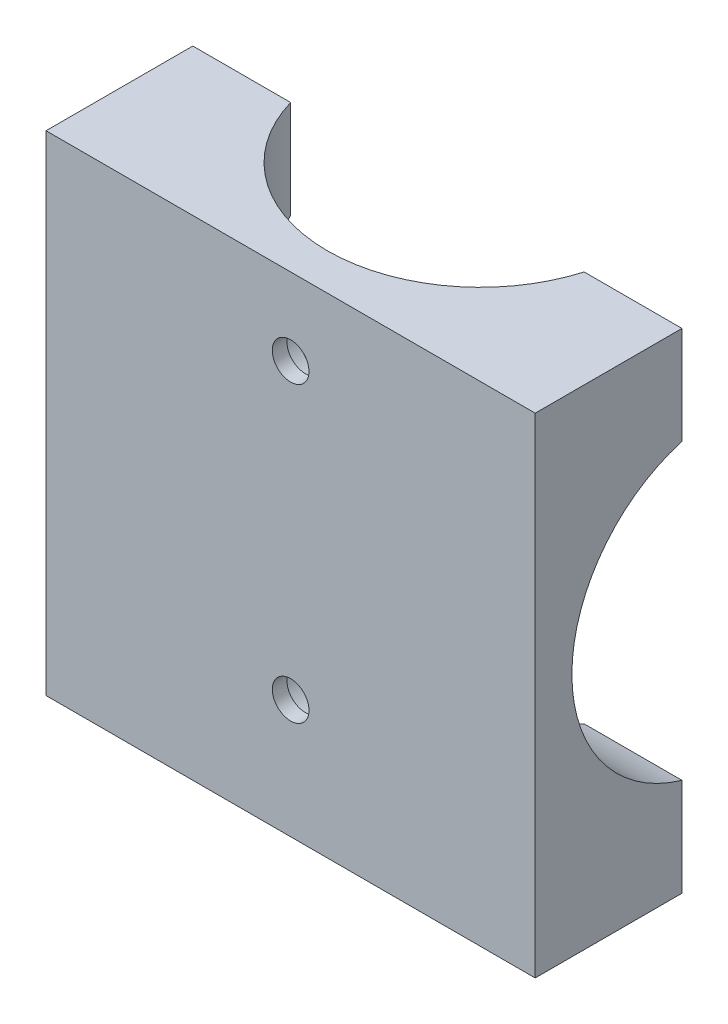
from build123d import *

# Parameters (mm, degrees)
SKETCH1_W           = 40
SKETCH1_H           = 40
BOSS_EXTRUDE1_DEPTH = 12
SKETCH3_R           = 12.5
CUT_EXTRUDE3_DEPTH  = 40
SKETCH11_R          = 12.5
CUT_EXTRUDE4_DEPTH  = 40
SKETCH14_R          = 3
CUT_EXTRUDE7_DEPTH  = 30
SKETCH14_5_R        = 3
SKETCH14_5_R_2      = 1.5
BOSS_EXTRUDE2_DEPTH = 1.2


with BuildPart() as part:
    # Sketch1 → Boss-Extrude1 (new body)
    with BuildSketch(Plane.XY):
        with Locations((-10.055248619, -5.138121547)):
            Rectangle(SKETCH1_W, SKETCH1_H)
    extrude(amount=BOSS_EXTRUDE1_DEPTH)

    # Sketch3 → Cut-Extrude3 (cut)
    with BuildSketch(Plane(origin=(0, 14.861878453, 0), x_dir=(1, 0, 0), z_dir=(0, 1, 0))):
        with Locations((-10.055248619, 3.5)):
            Circle(SKETCH3_R)
    extrude(amount=-CUT_EXTRUDE3_DEPTH, mode=Mode.SUBTRACT)

    # Sketch11 → Cut-Extrude4 (cut)
    with BuildSketch(Plane(origin=(9.944751381, 0, 0), x_dir=(0, 0, -1), z_dir=(1, 0, 0))):
        with Locations((3.5, -5.138121547)):
            Circle(SKETCH11_R)
    extrude(amount=-CUT_EXTRUDE4_DEPTH, mode=Mode.SUBTRACT)

    # Sketch14 → Cut-Extrude7 (cut)
    with BuildSketch(Plane.XY.offset(12)):
        with Locations((-10.055248619, 8.561878453)):
            Circle(SKETCH14_R)
        with Locations((-10.055248619, -15.438121547)):
            Circle(SKETCH14_R)
    extrude(amount=-CUT_EXTRUDE7_DEPTH, mode=Mode.SUBTRACT)

    # Sketch14<5> → Boss-Extrude2 (add)
    # profile 1 of 2: a face of its own
    with BuildSketch(Plane.XY.offset(12)):
        with Locations((-10.055248619, 8.561878453)):
            Circle(SKETCH14_5_R)
        with Locations((-10.055248619, 8.561878453)):
            Circle(SKETCH14_5_R_2, mode=Mode.SUBTRACT)
    # profile 2 of 2: a face of its own
    with BuildSketch(Plane.XY.offset(12)):
        with Locations((-10.055248619, -15.438121547)):
            Circle(SKETCH14_5_R)
        with Locations((-10.055248619, -15.438121547)):
            Circle(SKETCH14_5_R_2, mode=Mode.SUBTRACT)
    extrude(amount=-BOSS_EXTRUDE2_DEPTH)


solid = part.part
